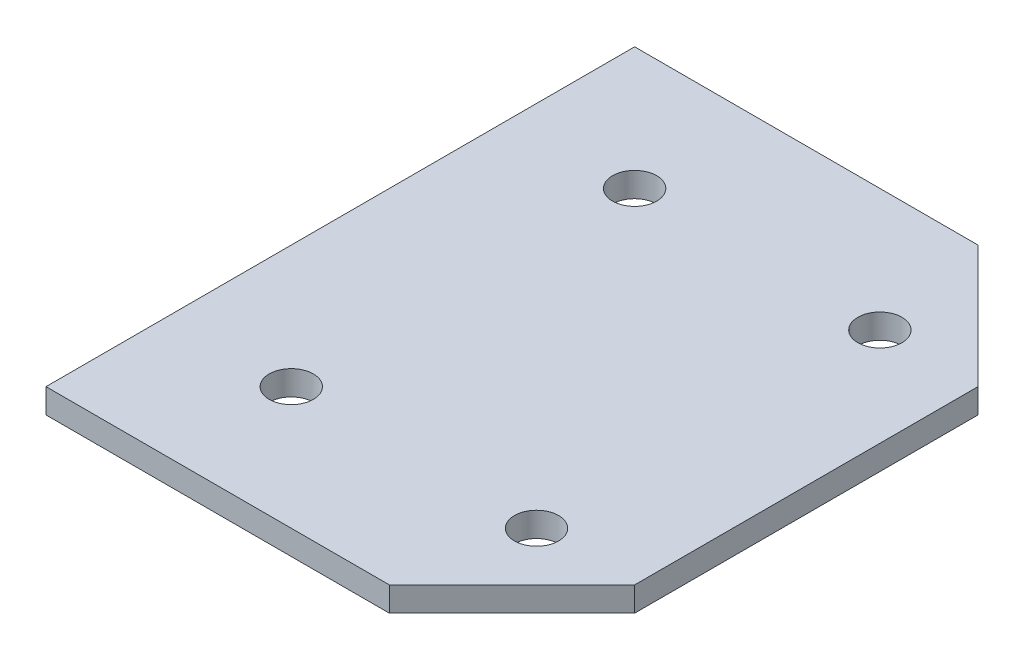
from build123d import *

# Parameters (mm, degrees)
BOSS_EXTRUDE1_DEPTH = 1
SKETCH2_R           = 0.9
CUT_EXTRUDE1_DEPTH  = 85.182158204


with BuildPart() as part:
    # Sketch1 → Boss-Extrude1 (new body)
    with BuildSketch(Plane(origin=(0, 0, 0), x_dir=(1, 0, 0), z_dir=(0, 1, 0))):
        Polygon((43.27450468, -56.634987656), (43.27450468, -32.634987656), (57.27450468, -32.634987656), (62.27450468, -37.634987656), (62.27450468, -51.634987656), (57.27450468, -56.634987656), align=None)
    extrude(amount=BOSS_EXTRUDE1_DEPTH)

    # Sketch2 → Cut-Extrude1 (cut, through all)
    with BuildSketch(Plane(origin=(0, 1, 0), x_dir=(1, 0, 0), z_dir=(0, 1, 0))):
        with Locations(Location((58.27450468, -51.634987656, 0), (0, 0, 270))):
            Circle(SKETCH2_R)
        with Locations(Location((48.27450468, -51.634987656, 0), (0, 0, 270))):
            Circle(SKETCH2_R)
        with Locations(Location((48.27450468, -37.634987656, 0), (0, 0, 270))):
            Circle(SKETCH2_R)
        with Locations(Location((58.27450468, -37.634987656, 0), (0, 0, 270))):
            Circle(SKETCH2_R)
    extrude(amount=-CUT_EXTRUDE1_DEPTH, mode=Mode.SUBTRACT)


solid = part.part
